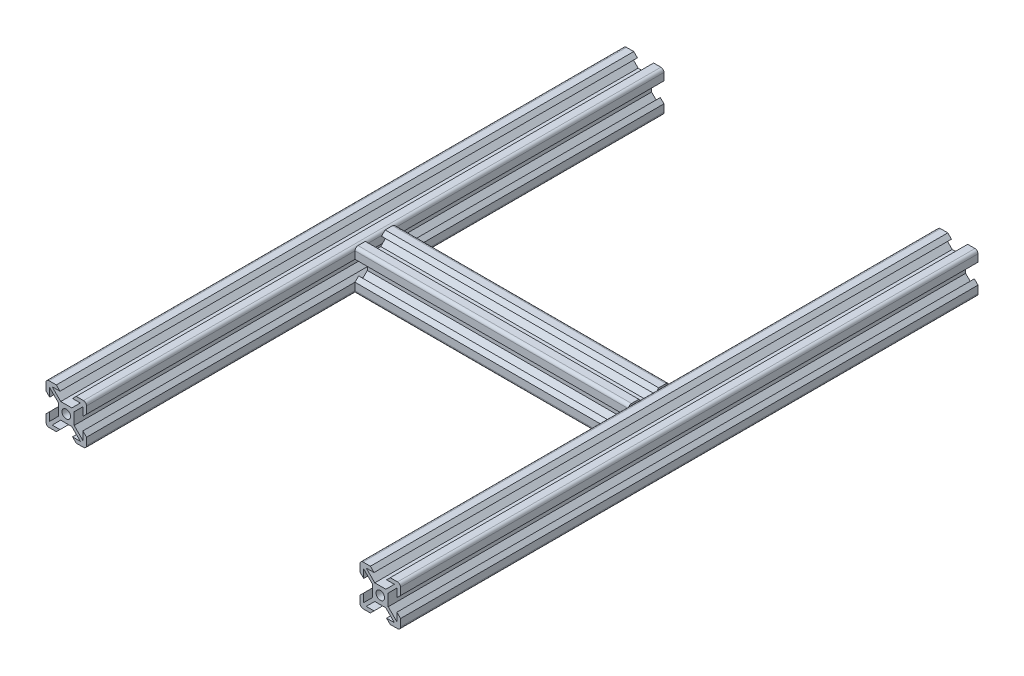
from build123d import *

# Parameters (mm, degrees)
SKETCH11_R                         = 2.1
ALUMINIUM_EXTRUSION_2020_1_DEPTH   = 285
SKETCH11_ON_SEGMENT_2_R            = 2.1
ALUMINIUM_EXTRUSION_2020_1_2_DEPTH = 285
SKETCH11_ON_SEGMENT_3_R            = 2.1
ALUMINIUM_EXTRUSION_2020_1_3_DEPTH = 157


with BuildPart() as part:
    # Sketch11 → Aluminium extrusion 2020(1) (new body)
    with BuildSketch(Plane(origin=(-77.5, 0, -142.5), x_dir=(1, 0, 0), z_dir=(0, 0, 1))):
        with BuildLine():
            Line((-2.731536985, 3.980660172), (-6.950876813, 8.2))
            Line((-6.950876813, 8.2), (-3.1, 8.2))
            Line((-3.1, 8.2), (-4.9, 10))
            Line((-4.9, 10), (-8.5, 10))
            ThreePointArc((-8.5, 10), (-9.560660172, 9.560660172), (-10, 8.5))
            Line((-10, 8.5), (-10, 4.9))
            Line((-10, 4.9), (-8.2, 3.1))
            Line((-8.2, 3.1), (-8.2, 7.219339828))
            Line((-8.2, 7.219339828), (-3.900660172, 2.92))
            Line((-3.900660172, 2.92), (-3.900660172, -2.92))
            Line((-3.900660172, -2.92), (-8.2, -7.219339828))
            Line((-8.2, -7.219339828), (-8.2, -3.1))
            Line((-8.2, -3.1), (-10, -4.9))
            Line((-10, -4.9), (-10, -8.5))
            ThreePointArc((-10, -8.5), (-9.560660172, -9.560660172), (-8.5, -10))
            Line((-8.5, -10), (-4.9, -10))
            Line((-4.9, -10), (-3.1, -8.2))
            Line((-3.1, -8.2), (-6.950876813, -8.2))
            Line((-6.950876813, -8.2), (-2.731536985, -3.980660172))
            Line((-2.731536985, -3.980660172), (2.731536985, -3.980660172))
            Line((2.731536985, -3.980660172), (6.950876813, -8.2))
            Line((6.950876813, -8.2), (3.1, -8.2))
            Line((3.1, -8.2), (4.9, -10))
            Line((4.9, -10), (8.5, -10))
            ThreePointArc((8.5, -10), (9.560660172, -9.560660172), (10, -8.5))
            Line((10, -8.5), (10, -4.9))
            Line((10, -4.9), (8.2, -3.1))
            Line((8.2, -3.1), (8.2, -7.219339828))
            Line((8.2, -7.219339828), (3.900660172, -2.92))
            Line((3.900660172, -2.92), (3.900660172, 2.92))
            Line((3.900660172, 2.92), (8.2, 7.219339828))
            Line((8.2, 7.219339828), (8.2, 3.1))
            Line((8.2, 3.1), (10, 4.9))
            Line((10, 4.9), (10, 8.5))
            ThreePointArc((10, 8.5), (9.560660172, 9.560660172), (8.5, 10))
            Line((8.5, 10), (4.9, 10))
            Line((4.9, 10), (3.1, 8.2))
            Line((3.1, 8.2), (6.950876813, 8.2))
            Line((6.950876813, 8.2), (2.731536985, 3.980660172))
            Line((2.731536985, 3.980660172), (-2.731536985, 3.980660172))
        make_face()
        Circle(SKETCH11_R, mode=Mode.SUBTRACT)
    extrude(amount=ALUMINIUM_EXTRUSION_2020_1_DEPTH)


with BuildPart() as body_2:
    # Sketch11 on segment 2 (carried to segment 2) → Aluminium extrusion 2020_1 2 (new body)
    with BuildSketch(Plane(origin=(77.5, 0, -142.5), x_dir=(1, 0, 0), z_dir=(0, 0, 1))):
        with BuildLine():
            Line((-2.731536985, 3.980660172), (-6.950876813, 8.2))
            Line((-6.950876813, 8.2), (-3.1, 8.2))
            Line((-3.1, 8.2), (-4.9, 10))
            Line((-4.9, 10), (-8.5, 10))
            ThreePointArc((-8.5, 10), (-9.560660172, 9.560660172), (-10, 8.5))
            Line((-10, 8.5), (-10, 4.9))
            Line((-10, 4.9), (-8.2, 3.1))
            Line((-8.2, 3.1), (-8.2, 7.219339828))
            Line((-8.2, 7.219339828), (-3.900660172, 2.92))
            Line((-3.900660172, 2.92), (-3.900660172, -2.92))
            Line((-3.900660172, -2.92), (-8.2, -7.219339828))
            Line((-8.2, -7.219339828), (-8.2, -3.1))
            Line((-8.2, -3.1), (-10, -4.9))
            Line((-10, -4.9), (-10, -8.5))
            ThreePointArc((-10, -8.5), (-9.560660172, -9.560660172), (-8.5, -10))
            Line((-8.5, -10), (-4.9, -10))
            Line((-4.9, -10), (-3.1, -8.2))
            Line((-3.1, -8.2), (-6.950876813, -8.2))
            Line((-6.950876813, -8.2), (-2.731536985, -3.980660172))
            Line((-2.731536985, -3.980660172), (2.731536985, -3.980660172))
            Line((2.731536985, -3.980660172), (6.950876813, -8.2))
            Line((6.950876813, -8.2), (3.1, -8.2))
            Line((3.1, -8.2), (4.9, -10))
            Line((4.9, -10), (8.5, -10))
            ThreePointArc((8.5, -10), (9.560660172, -9.560660172), (10, -8.5))
            Line((10, -8.5), (10, -4.9))
            Line((10, -4.9), (8.2, -3.1))
            Line((8.2, -3.1), (8.2, -7.219339828))
            Line((8.2, -7.219339828), (3.900660172, -2.92))
            Line((3.900660172, -2.92), (3.900660172, 2.92))
            Line((3.900660172, 2.92), (8.2, 7.219339828))
            Line((8.2, 7.219339828), (8.2, 3.1))
            Line((8.2, 3.1), (10, 4.9))
            Line((10, 4.9), (10, 8.5))
            ThreePointArc((10, 8.5), (9.560660172, 9.560660172), (8.5, 10))
            Line((8.5, 10), (4.9, 10))
            Line((4.9, 10), (3.1, 8.2))
            Line((3.1, 8.2), (6.950876813, 8.2))
            Line((6.950876813, 8.2), (2.731536985, 3.980660172))
            Line((2.731536985, 3.980660172), (-2.731536985, 3.980660172))
        make_face()
        Circle(SKETCH11_ON_SEGMENT_2_R, mode=Mode.SUBTRACT)
    extrude(amount=ALUMINIUM_EXTRUSION_2020_1_2_DEPTH)


with BuildPart() as body_3:
    # Sketch11 on segment 3 (carried to segment 3) → Aluminium extrusion 2020_1 3 (new body)
    with BuildSketch(Plane.ZY.offset(-78.5)):
        with BuildLine():
            Line((-2.731536985, 3.980660172), (-6.950876813, 8.2))
            Line((-6.950876813, 8.2), (-3.1, 8.2))
            Line((-3.1, 8.2), (-4.9, 10))
            Line((-4.9, 10), (-8.5, 10))
            ThreePointArc((-8.5, 10), (-9.560660172, 9.560660172), (-10, 8.5))
            Line((-10, 8.5), (-10, 4.9))
            Line((-10, 4.9), (-8.2, 3.1))
            Line((-8.2, 3.1), (-8.2, 7.219339828))
            Line((-8.2, 7.219339828), (-3.900660172, 2.92))
            Line((-3.900660172, 2.92), (-3.900660172, -2.92))
            Line((-3.900660172, -2.92), (-8.2, -7.219339828))
            Line((-8.2, -7.219339828), (-8.2, -3.1))
            Line((-8.2, -3.1), (-10, -4.9))
            Line((-10, -4.9), (-10, -8.5))
            ThreePointArc((-10, -8.5), (-9.560660172, -9.560660172), (-8.5, -10))
            Line((-8.5, -10), (-4.9, -10))
            Line((-4.9, -10), (-3.1, -8.2))
            Line((-3.1, -8.2), (-6.950876813, -8.2))
            Line((-6.950876813, -8.2), (-2.731536985, -3.980660172))
            Line((-2.731536985, -3.980660172), (2.731536985, -3.980660172))
            Line((2.731536985, -3.980660172), (6.950876813, -8.2))
            Line((6.950876813, -8.2), (3.1, -8.2))
            Line((3.1, -8.2), (4.9, -10))
            Line((4.9, -10), (8.5, -10))
            ThreePointArc((8.5, -10), (9.560660172, -9.560660172), (10, -8.5))
            Line((10, -8.5), (10, -4.9))
            Line((10, -4.9), (8.2, -3.1))
            Line((8.2, -3.1), (8.2, -7.219339828))
            Line((8.2, -7.219339828), (3.900660172, -2.92))
            Line((3.900660172, -2.92), (3.900660172, 2.92))
            Line((3.900660172, 2.92), (8.2, 7.219339828))
            Line((8.2, 7.219339828), (8.2, 3.1))
            Line((8.2, 3.1), (10, 4.9))
            Line((10, 4.9), (10, 8.5))
            ThreePointArc((10, 8.5), (9.560660172, 9.560660172), (8.5, 10))
            Line((8.5, 10), (4.9, 10))
            Line((4.9, 10), (3.1, 8.2))
            Line((3.1, 8.2), (6.950876813, 8.2))
            Line((6.950876813, 8.2), (2.731536985, 3.980660172))
            Line((2.731536985, 3.980660172), (-2.731536985, 3.980660172))
        make_face()
        Circle(SKETCH11_ON_SEGMENT_3_R, mode=Mode.SUBTRACT)
    extrude(amount=ALUMINIUM_EXTRUSION_2020_1_3_DEPTH)

    # Aluminium extrusion 2020_1 3 end butt 1
    split(bisect_by=Plane(origin=(67.5, 0, 0), x_dir=(0, -1, 0), z_dir=(-1, 0, 0)), keep=Keep.TOP)

    # Aluminium extrusion 2020_1 3 end butt 2
    split(bisect_by=Plane.YZ.offset(-67.5), keep=Keep.TOP)


solid = Compound([part.part, body_2.part, body_3.part])
